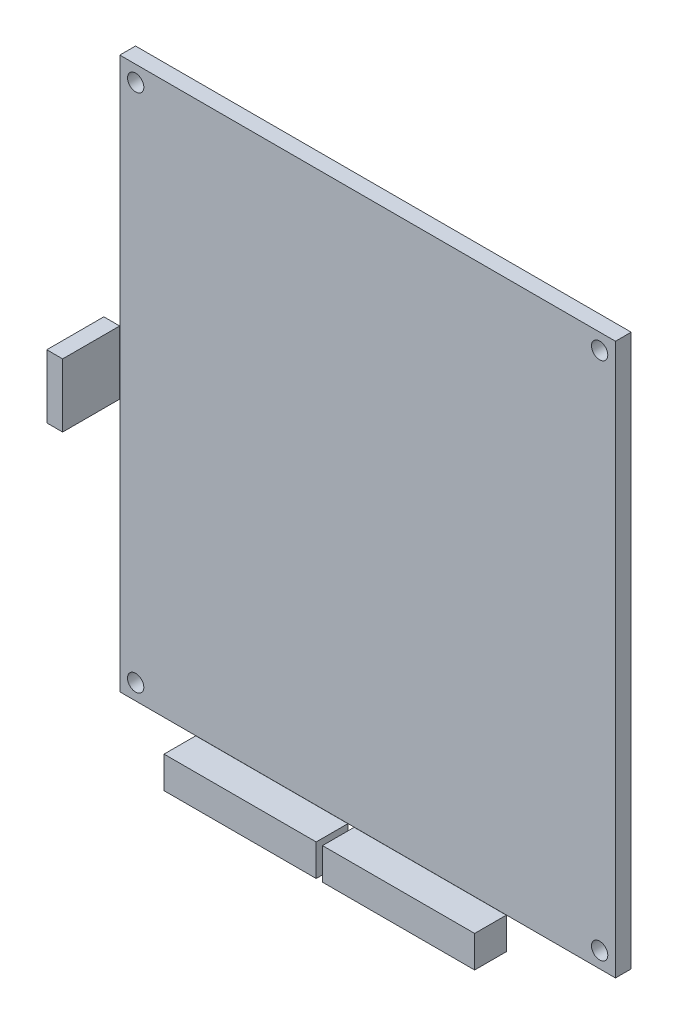
from build123d import *

# Parameters (mm, degrees)
SKETCH1_W                      = 99.314
SKETCH1_H                      = 110.49
EXTRUDE1_DEPTH                 = 3.1496
SKETCH2_W                      = 30.48
SKETCH2_H                      = 6.35
EXTRUDE2_DEPTH                 = 6.35
EXTRUDE2_2_DEPTH               = 6.35
SKETCH3_W                      = 11.43
SKETCH3_H                      = 12.7
EXTRUDE3_DEPTH                 = 3.175
SKETCH5_W                      = 1.63195
SKETCH5_H                      = 3.1496
F_4_CLEARANCE_HOLE1_AT_2_COUNT = 2
F_4_CLEARANCE_HOLE1_AT_2_PITCH = 104.14
MIRROR1_COPY_1_SKETCH_W        = 1.63195
MIRROR1_COPY_1_SKETCH_H        = 3.1496


with BuildPart() as part:
    # Sketch1 → Extrude1 (new body)
    with BuildSketch(Plane.XY):
        Rectangle(SKETCH1_W, SKETCH1_H)
    extrude(amount=EXTRUDE1_DEPTH)

    # Sketch5 → #4 Clearance Hole1 (revolve, cut)
    with BuildSketch(Plane(origin=(-46.482, 52.07, 3.1496), x_dir=(0, -1, 0), z_dir=(1, 0, 0))):
        with Locations((0.815975, 1.5748)):
            Rectangle(SKETCH5_W, SKETCH5_H)
    f_4_clearance_hole1 = revolve(axis=Axis((-46.482, 52.07, 9.4996), (0, 0, -1)), mode=Mode.SUBTRACT)

    # #4 Clearance Hole1 at 2: #4 Clearance Hole1 ×2
    with Locations(*[(0, -i * F_4_CLEARANCE_HOLE1_AT_2_PITCH, 0) for i in range(1, F_4_CLEARANCE_HOLE1_AT_2_COUNT)]):
        add(f_4_clearance_hole1, mode=Mode.SUBTRACT)

    # Mirror1: #4 Clearance Hole1 across plane
    add(f_4_clearance_hole1.mirror(Plane(origin=(0, 0, 0), x_dir=(0, 0, 1), z_dir=(1, 0, 0))), mode=Mode.SUBTRACT)

    # Mirror1 copy 1 sketch → Mirror1 copy 1 (revolve, cut)
    with BuildSketch(Plane(origin=(46.482, -52.07, 3.1496), x_dir=(0, -1, 0), z_dir=(-1, 0, 0))):
        with Locations((0.815975, -1.5748)):
            Rectangle(MIRROR1_COPY_1_SKETCH_W, MIRROR1_COPY_1_SKETCH_H)
    revolve(axis=Axis((46.482, -52.07, 9.4996), (0, 0, 1)), mode=Mode.SUBTRACT)


with BuildPart() as body_2:
    # Sketch2 → Extrude2 (new body)
    with BuildSketch(Plane.XZ.offset(55.245)):
        with Locations((-19.177, 6.35)):
            Rectangle(SKETCH2_W, SKETCH2_H)
    extrude(amount=EXTRUDE2_DEPTH)


with BuildPart() as body_3:
    # Sketch2 → Extrude2 2 (new body)
    with BuildSketch(Plane.XZ.offset(55.245)):
        with Locations((12.573, 6.35)):
            Rectangle(SKETCH2_W, SKETCH2_H)
    extrude(amount=EXTRUDE2_2_DEPTH)


with BuildPart() as body_4:
    # Sketch3 → Extrude3 (new body)
    with BuildSketch(Plane.ZY.offset(49.657)):
        with Locations((8.89, 1.905)):
            Rectangle(SKETCH3_W, SKETCH3_H)
    extrude(amount=EXTRUDE3_DEPTH)


solid = Compound([part.part, body_2.part, body_3.part, body_4.part])
